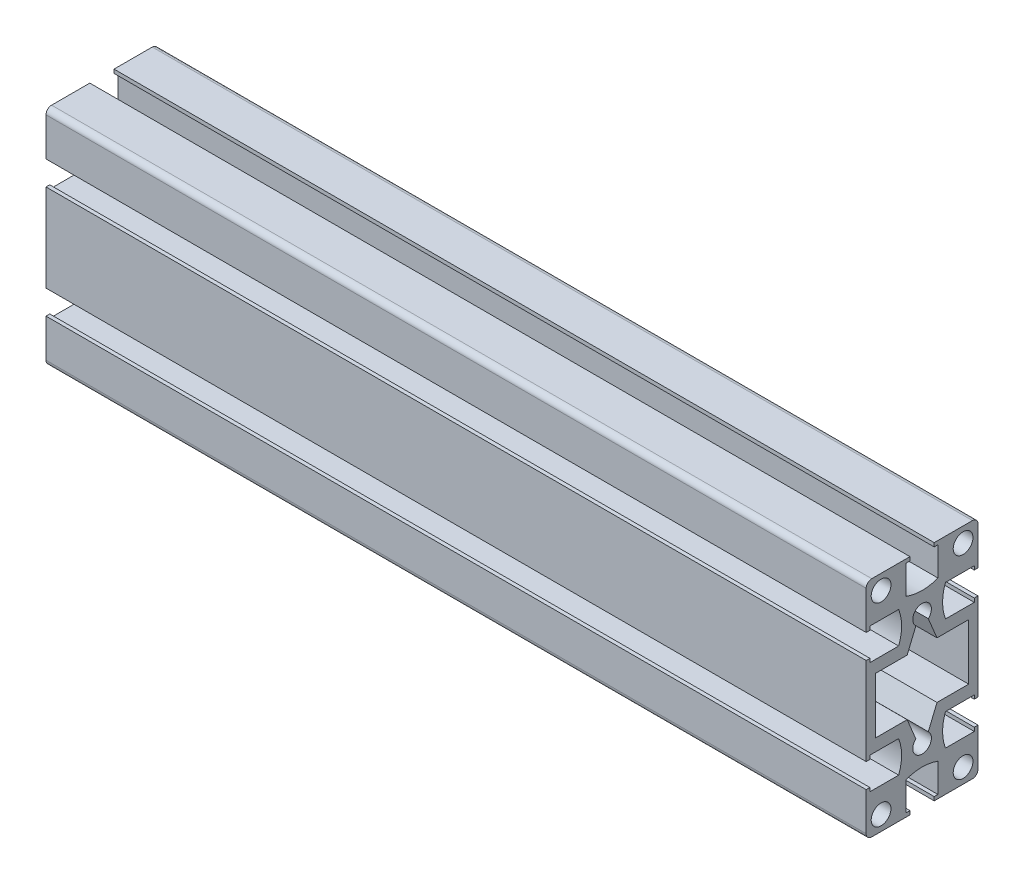
from build123d import *

# Parameters (mm, degrees)
SKETCH1_R                 = 2.65
F_30_X_60G_X_R1_5_1_DEPTH = 220


with BuildPart() as part:
    # Sketch1 → 铝型材 30 X 60G X R1.5(1) (new body)
    with BuildSketch(Plane(origin=(0, 0, 0), x_dir=(0, 0, -1), z_dir=(1, 0, 0))):
        with BuildLine():
            Line((-3.25, 30), (-3.25, 29))
            Line((-3.25, 29), (-4.25, 29))
            Line((-4.25, 29), (-4.25, 21.277812156))
            ThreePointArc((-4.25, 21.277812156), (0, 20.5), (4.25, 21.277812156))
            Line((4.25, 21.277812156), (4.25, 29))
            Line((4.25, 29), (3.25, 29))
            Line((3.25, 29), (3.25, 30))
            Line((3.25, 30), (13.5, 30))
            ThreePointArc((13.5, 30), (14.560660172, 29.560660172), (15, 28.5))
            Line((15, 28.5), (15, 18.25))
            Line((15, 18.25), (14, 18.25))
            Line((14, 18.25), (14, 19.25))
            Line((14, 19.25), (6.277812156, 19.25))
            ThreePointArc((6.277812156, 19.25), (5.5, 15), (6.277812156, 10.75))
            Line((6.277812156, 10.75), (14, 10.75))
            Line((14, 10.75), (14, 11.75))
            Line((14, 11.75), (15, 11.75))
            Line((15, 11.75), (15, -11.75))
            Line((15, -11.75), (14, -11.75))
            Line((14, -11.75), (14, -10.75))
            Line((14, -10.75), (6.277812156, -10.75))
            ThreePointArc((6.277812156, -10.75), (5.5, -15), (6.277812156, -19.25))
            Line((6.277812156, -19.25), (14, -19.25))
            Line((14, -19.25), (14, -18.25))
            Line((14, -18.25), (15, -18.25))
            Line((15, -18.25), (15, -28.5))
            ThreePointArc((15, -28.5), (14.560660172, -29.560660172), (13.5, -30))
            Line((13.5, -30), (3.25, -30))
            Line((3.25, -30), (3.25, -29))
            Line((3.25, -29), (4.25, -29))
            Line((4.25, -29), (4.25, -21.277812156))
            ThreePointArc((4.25, -21.277812156), (0, -20.5), (-4.25, -21.277812156))
            Line((-4.25, -21.277812156), (-4.25, -29))
            Line((-4.25, -29), (-3.25, -29))
            Line((-3.25, -29), (-3.25, -30))
            Line((-3.25, -30), (-13.5, -30))
            ThreePointArc((-13.5, -30), (-14.560660172, -29.560660172), (-15, -28.5))
            Line((-15, -28.5), (-15, -18.25))
            Line((-15, -18.25), (-14, -18.25))
            Line((-14, -18.25), (-14, -19.25))
            Line((-14, -19.25), (-6.277812156, -19.25))
            ThreePointArc((-6.277812156, -19.25), (-5.5, -15), (-6.277812156, -10.75))
            Line((-6.277812156, -10.75), (-14, -10.75))
            Line((-14, -10.75), (-14, -11.75))
            Line((-14, -11.75), (-15, -11.75))
            Line((-15, -11.75), (-15, 11.75))
            Line((-15, 11.75), (-14, 11.75))
            Line((-14, 11.75), (-14, 10.75))
            Line((-14, 10.75), (-6.277812156, 10.75))
            ThreePointArc((-6.277812156, 10.75), (-5.5, 15), (-6.277812156, 19.25))
            Line((-6.277812156, 19.25), (-14, 19.25))
            Line((-14, 19.25), (-14, 18.25))
            Line((-14, 18.25), (-15, 18.25))
            Line((-15, 18.25), (-15, 28.5))
            ThreePointArc((-15, 28.5), (-14.560660172, 29.560660172), (-13.5, 30))
            Line((-13.5, 30), (-3.25, 30))
        make_face()
        with Locations((-11, 26)):
            Circle(SKETCH1_R, mode=Mode.SUBTRACT)
        with Locations((11, 26)):
            Circle(SKETCH1_R, mode=Mode.SUBTRACT)
        with Locations((11, -26)):
            Circle(SKETCH1_R, mode=Mode.SUBTRACT)
        with Locations((-11, -26)):
            Circle(SKETCH1_R, mode=Mode.SUBTRACT)
        with BuildLine():
            Line((-12.5, 7.5), (-4, 7.5))
            Line((-4, 7.5), (-1.665625283, 13.135679101))
            ThreePointArc((-1.665625283, 13.135679101), (0, 17.5), (1.665625283, 13.135679101))
            Line((1.665625283, 13.135679101), (4, 7.5))
            Line((4, 7.5), (12.5, 7.5))
            Line((12.5, 7.5), (12.5, -7.5))
            Line((12.5, -7.5), (4, -7.5))
            Line((4, -7.5), (1.665625283, -13.135679101))
            ThreePointArc((1.665625283, -13.135679101), (0, -17.5), (-1.665625283, -13.135679101))
            Line((-1.665625283, -13.135679101), (-4, -7.5))
            Line((-4, -7.5), (-12.5, -7.5))
            Line((-12.5, -7.5), (-12.5, 7.5))
        make_face(mode=Mode.SUBTRACT)
    extrude(amount=F_30_X_60G_X_R1_5_1_DEPTH)


solid = part.part
